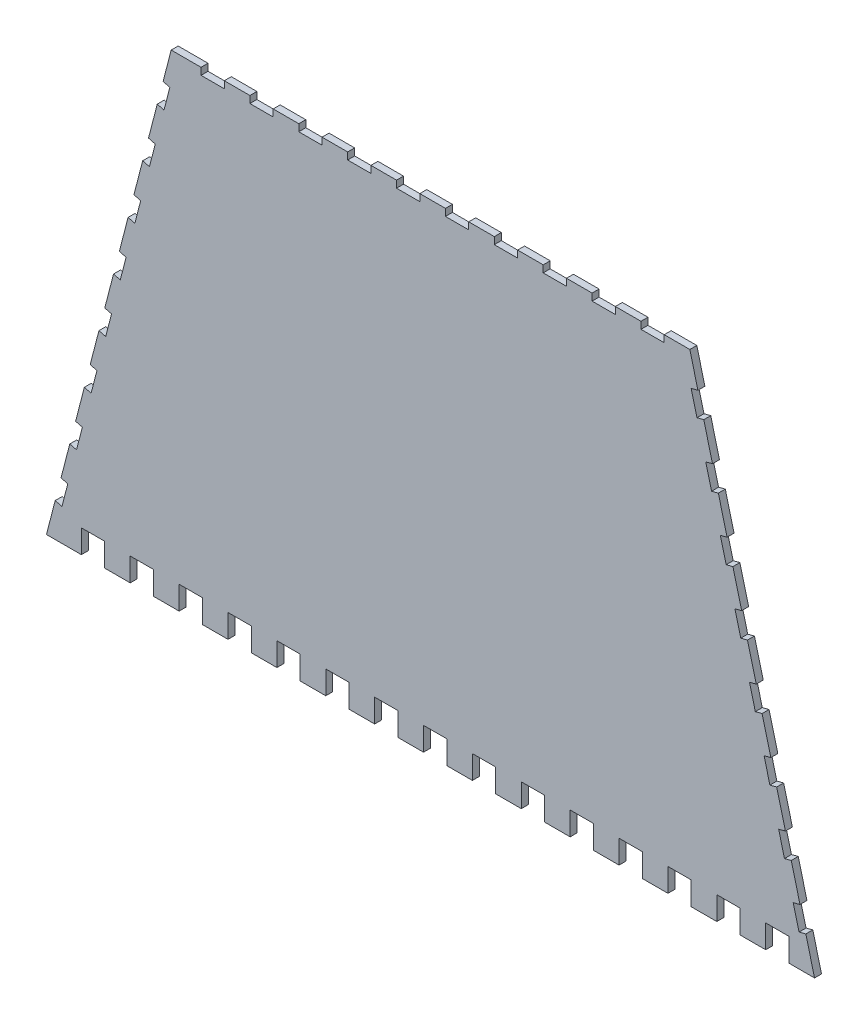
from build123d import *

# Parameters (mm, degrees)
BOSS_EXTRUDE1_DEPTH  = 3
CUT_EXTRUDE1_DEPTH   = 3
LPATTERN1_COUNT      = 8
LPATTERN1_PITCH      = 25
MIRROR1_COPY_1_DEPTH = 3
MIRROR1_COPY_2_DEPTH = 3
MIRROR1_COPY_3_DEPTH = 3
MIRROR1_COPY_4_DEPTH = 3
MIRROR1_COPY_5_DEPTH = 3
MIRROR1_COPY_6_DEPTH = 3
MIRROR1_COPY_7_DEPTH = 3
CUT_EXTRUDE3_START   = -3
CUT_EXTRUDE3_DEPTH   = 236.905459961
LPATTERN2_COUNT      = 15
LPATTERN2_PITCH      = 21
CUT_EXTRUDE5_START   = -3
CUT_EXTRUDE5_DEPTH   = 236.905459961
LPATTERN3_COUNT      = 10
LPATTERN3_PITCH      = 21


with BuildPart() as part:
    # Sketch2 → Boss-Extrude1 (new body)
    with BuildSketch(Plane.XY):
        Polygon((-111.410161514, 164.35009364), (111.410161514, 164.35009364), (165, -42.705142442), (-165, -42.705142442), align=None)
    extrude(amount=BOSS_EXTRUDE1_DEPTH)

    # Sketch3 → Cut-Extrude1 (cut)
    with BuildSketch(Plane(origin=(0, 0, 0), x_dir=(-1, 0, 0), z_dir=(0, 0, -1))):
        Polygon((-161.241557894, -28.183637254), (-158.337256856, -28.935325675), (-155.831628785, -19.254322216), (-158.735929823, -18.502633795), align=None)
    cut_extrude1 = extrude(amount=-CUT_EXTRUDE1_DEPTH, mode=Mode.SUBTRACT)

    # LPattern1: Cut-Extrude1 ×8
    with Locations(*[Vector(-0.25056280708573136, 0.9681003458863748, 0) * (i * LPATTERN1_PITCH) for i in range(1, LPATTERN1_COUNT)]):
        add(cut_extrude1, mode=Mode.SUBTRACT)

    # Mirror1: Cut-Extrude1 across plane
    add(cut_extrude1.mirror(Plane(origin=(0, 0, 0), x_dir=(0, 0, 1), z_dir=(1, 0, 0))), mode=Mode.SUBTRACT)

    # Mirror1 copy 1 sketch → Mirror1 copy 1 (cut)
    with BuildSketch(Plane(origin=(6.264070177, 24.202508647, 0), x_dir=(1, 0, 0), z_dir=(0, 0, -1))):
        Polygon((-161.241557894, 28.183637254), (-158.337256856, 28.935325675), (-155.831628785, 19.254322216), (-158.735929823, 18.502633795), align=None)
    extrude(amount=-MIRROR1_COPY_1_DEPTH, mode=Mode.SUBTRACT)

    # Mirror1 copy 2 sketch → Mirror1 copy 2 (cut)
    with BuildSketch(Plane(origin=(12.528140354, 48.405017294, 0), x_dir=(1, 0, 0), z_dir=(0, 0, -1))):
        Polygon((-161.241557894, 28.183637254), (-158.337256856, 28.935325675), (-155.831628785, 19.254322216), (-158.735929823, 18.502633795), align=None)
    extrude(amount=-MIRROR1_COPY_2_DEPTH, mode=Mode.SUBTRACT)

    # Mirror1 copy 3 sketch → Mirror1 copy 3 (cut)
    with BuildSketch(Plane(origin=(18.792210531, 72.607525941, 0), x_dir=(1, 0, 0), z_dir=(0, 0, -1))):
        Polygon((-161.241557894, 28.183637254), (-158.337256856, 28.935325675), (-155.831628785, 19.254322216), (-158.735929823, 18.502633795), align=None)
    extrude(amount=-MIRROR1_COPY_3_DEPTH, mode=Mode.SUBTRACT)

    # Mirror1 copy 4 sketch → Mirror1 copy 4 (cut)
    with BuildSketch(Plane(origin=(25.056280709, 96.810034589, 0), x_dir=(1, 0, 0), z_dir=(0, 0, -1))):
        Polygon((-161.241557894, 28.183637254), (-158.337256856, 28.935325675), (-155.831628785, 19.254322216), (-158.735929823, 18.502633795), align=None)
    extrude(amount=-MIRROR1_COPY_4_DEPTH, mode=Mode.SUBTRACT)

    # Mirror1 copy 5 sketch → Mirror1 copy 5 (cut)
    with BuildSketch(Plane(origin=(31.320350886, 121.012543236, 0), x_dir=(1, 0, 0), z_dir=(0, 0, -1))):
        Polygon((-161.241557894, 28.183637254), (-158.337256856, 28.935325675), (-155.831628785, 19.254322216), (-158.735929823, 18.502633795), align=None)
    extrude(amount=-MIRROR1_COPY_5_DEPTH, mode=Mode.SUBTRACT)

    # Mirror1 copy 6 sketch → Mirror1 copy 6 (cut)
    with BuildSketch(Plane(origin=(37.584421063, 145.215051883, 0), x_dir=(1, 0, 0), z_dir=(0, 0, -1))):
        Polygon((-161.241557894, 28.183637254), (-158.337256856, 28.935325675), (-155.831628785, 19.254322216), (-158.735929823, 18.502633795), align=None)
    extrude(amount=-MIRROR1_COPY_6_DEPTH, mode=Mode.SUBTRACT)

    # Mirror1 copy 7 sketch → Mirror1 copy 7 (cut)
    with BuildSketch(Plane(origin=(43.84849124, 169.41756053, 0), x_dir=(1, 0, 0), z_dir=(0, 0, -1))):
        Polygon((-161.241557894, 28.183637254), (-158.337256856, 28.935325675), (-155.831628785, 19.254322216), (-158.735929823, 18.502633795), align=None)
    extrude(amount=-MIRROR1_COPY_7_DEPTH, mode=Mode.SUBTRACT)

    # Sketch4 → Cut-Extrude3 (cut)
    with BuildSketch(Plane(origin=(0, 0, 0), x_dir=(-1, 0, 0), z_dir=(0, 0, -1)).offset(CUT_EXTRUDE3_START)):
        Polygon((-154, -813.317713437), (-154, -42.705142442), (-154, -32.705142442), (-144, -32.705142442), (-144, -42.705142442), (-144, -813.317713437), (-144, -2354.542855427), (-154, -2354.542855427), align=None)
    cut_extrude3 = extrude(amount=CUT_EXTRUDE3_DEPTH, mode=Mode.SUBTRACT)

    # LPattern2: Cut-Extrude3 ×15
    with Locations(*[(-i * LPATTERN2_PITCH, 0, 0) for i in range(1, LPATTERN2_COUNT)]):
        add(cut_extrude3, mode=Mode.SUBTRACT)

    # Sketch5 → Cut-Extrude5 (cut)
    with BuildSketch(Plane(origin=(0, 0, 0), x_dir=(-1, 0, 0), z_dir=(0, 0, -1)).offset(CUT_EXTRUDE5_START)):
        Polygon((-100.410161514, 847.594253284), (-100.410161514, 164.35009364), (-100.410161514, 161.35009364), (-90.410161514, 161.35009364), (-90.410161514, 164.35009364), (-90.410161514, 847.594253284), (-90.410161514, 2214.082572573), (-100.410161514, 2214.082572573), align=None)
    cut_extrude5 = extrude(amount=CUT_EXTRUDE5_DEPTH, mode=Mode.SUBTRACT)

    # LPattern3: Cut-Extrude5 ×10
    with Locations(*[(-i * LPATTERN3_PITCH, 0, 0) for i in range(1, LPATTERN3_COUNT)]):
        add(cut_extrude5, mode=Mode.SUBTRACT)


solid = part.part
